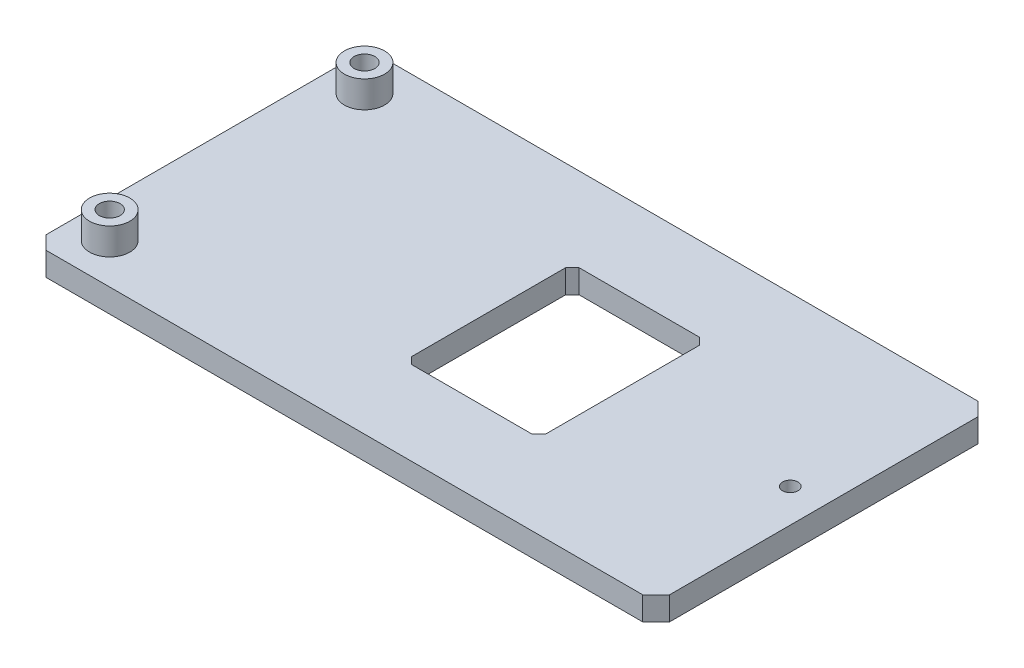
from build123d import *

# Parameters (mm, degrees)
BOSS_EXTRUDE1_DEPTH      = 3
BOSS_EXTRUDE1_DEPTH_BACK = 0.506598952
SKETCH1_R                = 1.15
SKETCH1_R_2              = 1.55
SKETCH2_R                = 3
SKETCH2_R_2              = 1.55
BOSS_EXTRUDE2_DEPTH      = 4


with BuildPart() as part:
    # Sketch1 → Boss-Extrude1 (new, two sides: drawn at the far end of the back side and taken through both)
    with BuildSketch(Plane(origin=(0, 0, 0), x_dir=(1, 0, 0), z_dir=(0, 1, 0)).offset(-BOSS_EXTRUDE1_DEPTH_BACK)):
        Polygon((-48.674262421, -25), (40.325737579, -25), (42.325737579, -23), (42.325737579, 23), (40.325737579, 25), (-48.674262421, 25), (-50.674262421, 23), (-50.674262421, -23), align=None)
        with Locations(Location((37.325737579, 0, 0), (0, 0, 270))):
            Circle(SKETCH1_R, mode=Mode.SUBTRACT)
        with Locations(Location((-45.174262421, 19, 0), (0, 0, 270))):
            Circle(SKETCH1_R_2, mode=Mode.SUBTRACT)
        with Locations(Location((-45.174262421, -19, 0), (0, 0, 90))):
            Circle(SKETCH1_R_2, mode=Mode.SUBTRACT)
        Polygon((-6.674262421, -12.5), (11.325737579, -12.5), (12.325737579, -11.5), (12.325737579, 11.5), (11.325737579, 12.5), (-6.674262421, 12.5), (-7.674262421, 11.5), (-7.674262421, -11.5), align=None, mode=Mode.SUBTRACT)
    extrude(amount=BOSS_EXTRUDE1_DEPTH + BOSS_EXTRUDE1_DEPTH_BACK)

    # Sketch2 → Boss-Extrude2 (add)
    # profile 1 of 2: a face of its own
    with BuildSketch(Plane(origin=(0, 3, 0), x_dir=(1, 0, 0), z_dir=(0, 1, 0))):
        with Locations(Location((-45.174262421, 19, 0), (0, 0, 270))):
            Circle(SKETCH2_R)
        with Locations(Location((-45.174262421, 19, 0), (0, 0, 270))):
            Circle(SKETCH2_R_2, mode=Mode.SUBTRACT)
    # profile 2 of 2: a face of its own
    with BuildSketch(Plane(origin=(0, 3, 0), x_dir=(1, 0, 0), z_dir=(0, 1, 0))):
        with Locations(Location((-45.174262421, -19, 0), (0, 0, 90))):
            Circle(SKETCH2_R)
        with Locations(Location((-45.174262421, -19, 0), (0, 0, 90))):
            Circle(SKETCH2_R_2, mode=Mode.SUBTRACT)
    extrude(amount=BOSS_EXTRUDE2_DEPTH)


solid = part.part
